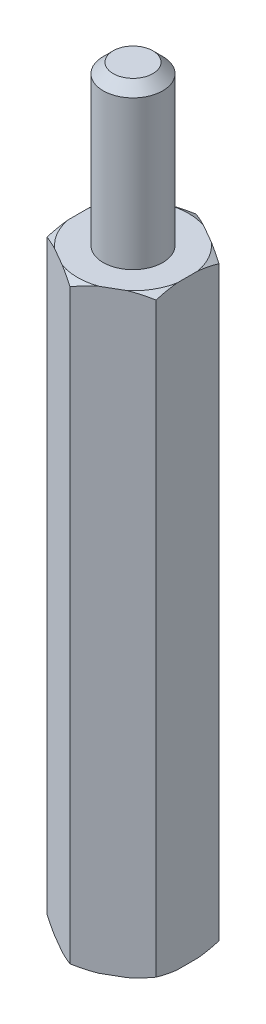
from build123d import *

# Parameters (mm, degrees)
EXTRUDE_1_DEPTH     = 30
SKETCH_3_R          = 1.5
EXTRUDE_2_DEPTH     = 8
CHAMFER_1_SIZE      = 0.5
SKETCH_1_3_R        = 1.5
CUT_EXTRUDE_1_DEPTH = 8


with BuildPart() as part:
    # Эскиз1 → Бобышка-Вытянуть1 (new body)
    with BuildSketch(Plane(origin=(0, 0, 0), x_dir=(1, 0, 0), z_dir=(0, 1, 0))):
        Polygon((2.75, 1.58771324), (0, 3.175426481), (-2.75, 1.58771324), (-2.75, -1.58771324), (0, -3.175426481), (2.75, -1.58771324), align=None)
    extrude(amount=EXTRUDE_1_DEPTH)

    # Эскиз2 → Вырез-Повернуть1 (revolve, cut)
    with BuildSketch(Plane(origin=(0, 0, 0), x_dir=(0, 0, -1), z_dir=(1, 0, 0))):
        Polygon((-26.160719749, 0), (-2.8, 0), (-26.160719749, 13.487317835), align=None)
        Polygon((-26.160719749, 16.512682165), (-2.8, 30), (-26.160719749, 30), align=None)
    revolve(axis=Axis((0, 30, 0), (0, -1, 0)), mode=Mode.SUBTRACT)

    # Эскиз3 → Бобышка-Вытянуть2 (add)
    with BuildSketch(Plane(origin=(0, 30, 0), x_dir=(1, 0, 0), z_dir=(0, 1, 0))):
        Circle(SKETCH_3_R)
    extrude(amount=EXTRUDE_2_DEPTH)

    # Фаска1
    chamfer_1_edges = [part.edges().sort_by_distance(p)[0] for p in [
        (-1.5, 38, 0),
    ]]
    chamfer(chamfer_1_edges, length=CHAMFER_1_SIZE)

    # Эскиз1<3> → Вырез-Вытянуть1 (cut)
    with BuildSketch(Plane(origin=(0, 0, 0), x_dir=(1, 0, 0), z_dir=(0, 1, 0))):
        Circle(SKETCH_1_3_R)
    extrude(amount=CUT_EXTRUDE_1_DEPTH, mode=Mode.SUBTRACT)


solid = part.part
